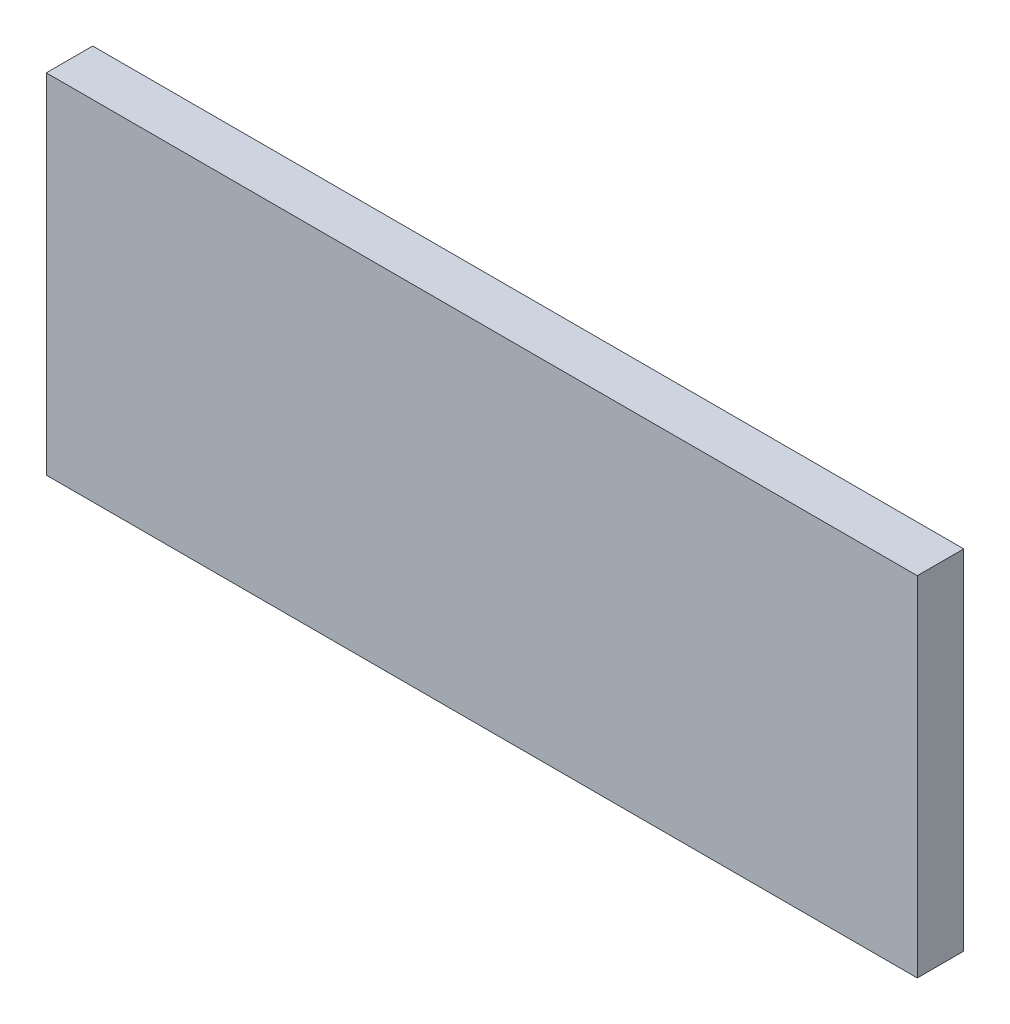
from build123d import *

# Parameters (mm, degrees)
SKETCH_1_W      = 150
SKETCH_1_H      = 60
EXTRUDE_1_DEPTH = 8


with BuildPart() as part:
    # 草图1 → 凸台-拉伸1 (new body)
    with BuildSketch(Plane.XY):
        with Locations((75, 30)):
            Rectangle(SKETCH_1_W, SKETCH_1_H)
    extrude(amount=EXTRUDE_1_DEPTH)


solid = part.part
